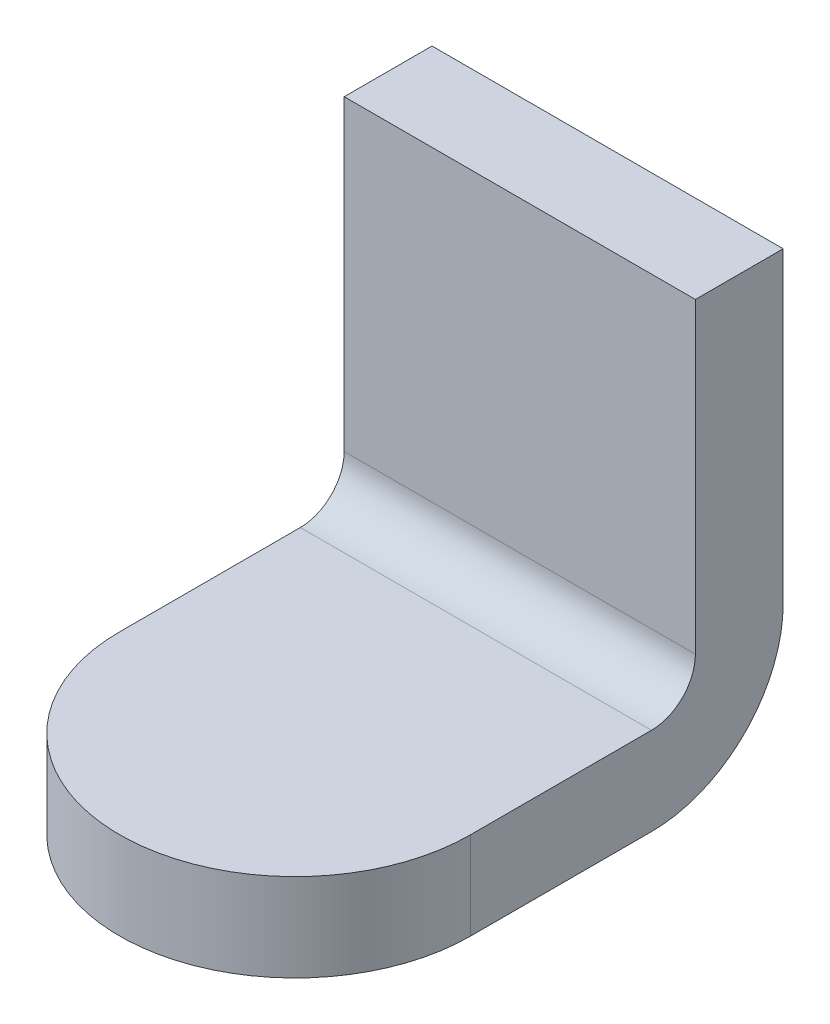
from build123d import *

# Parameters (mm, degrees)
SKETCH_3_R      = 40
EXTRUDE_1_DEPTH = 20
SKETCH_4_W      = 80
SKETCH_4_H      = 20
EXTRUDE_2_DEPTH = 80
FILLET_2_R      = 10
FILLET_3_R      = 30


with BuildPart() as part:
    # 草图3 → 凸台-拉伸1 (new body)
    with BuildSketch(Plane(origin=(0, 0, 0), x_dir=(1, 0, 0), z_dir=(0, 1, 0))):
        with BuildLine():
            Line((-40, 71.189389762), (-40, 0))
            ThreePointArc((-40, 0), (0, 40), (40, 0))
            Line((40, 0), (40, 71.189389762))
            Line((40, 71.189389762), (-40, 71.189389762))
        make_face()
        Circle(SKETCH_3_R)
    extrude(amount=EXTRUDE_1_DEPTH)

    # 草图4 → 凸台-拉伸2 (add)
    with BuildSketch(Plane(origin=(0, 20, 0), x_dir=(1, 0, 0), z_dir=(0, 1, 0))):
        with Locations((0, 61.189389762)):
            Rectangle(SKETCH_4_W, SKETCH_4_H)
    extrude(amount=EXTRUDE_2_DEPTH)

    # 圆角2
    fillet_2_edges = [part.edges().sort_by_distance(p)[0] for p in [
        (0, 20, -51.189389762),
    ]]
    fillet(fillet_2_edges, radius=FILLET_2_R)

    # 圆角3
    fillet_3_edges = [part.edges().sort_by_distance(p)[0] for p in [
        (0, 0, -71.189389762),
    ]]
    fillet(fillet_3_edges, radius=FILLET_3_R)


solid = part.part
